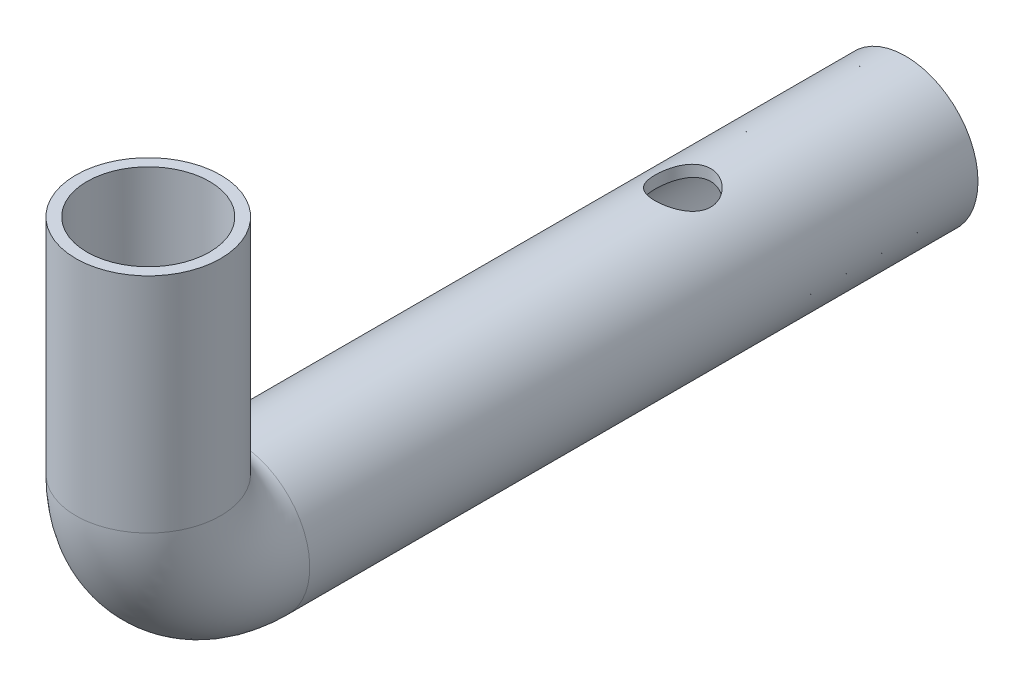
from build123d import *

# Parameters (mm, degrees)
SWEEP5_PROFILE_R        = 6.5
CUT_SWEEP1_PROFILE_R    = 5.5
CUT_EXTRUDE1_DEPTH      = 80.852990027
CUT_EXTRUDE1_DEPTH_BACK = 80.852990027
SKETCH30_R              = 2.5


with BuildPart() as part:
    # Sweep5: sweep along a path in Sketch2
    with BuildLine(Plane(origin=(0, 0, 0), x_dir=(0, 0, -1), z_dir=(1, 0, 0))) as sweep5_path:
        Line((0, 0), (-60, 0))
        ThreePointArc((-60, 0), (-65.656854249, 2.343145751), (-68, 8))
        Line((-68, 8), (-68, 28))
    # Sweep5 profile (on start of the path) → Sweep5 (sweep)
    with BuildSketch(Plane(origin=(0, 0, 0), x_dir=(0, 1, 0), z_dir=(0, 0, 1))):
        Circle(SWEEP5_PROFILE_R)
    sweep(path=sweep5_path.line)

    # Cut-Sweep1: sweep along a path in Sketch2<2>
    with BuildLine(Plane(origin=(0, 0, 0), x_dir=(0, 0, -1), z_dir=(1, 0, 0))) as cut_sweep1_path:
        Line((0, 0), (-60, 0))
        ThreePointArc((-60, 0), (-65.656854249, 2.343145751), (-68, 8))
        Line((-68, 8), (-68, 28))
    # Cut-Sweep1 profile (on start of the path) → Cut-Sweep1 (sweep, cut)
    with BuildSketch(Plane(origin=(0, 0, 0), x_dir=(0, 1, 0), z_dir=(0, 0, 1))):
        Circle(CUT_SWEEP1_PROFILE_R)
    sweep(path=cut_sweep1_path.line, mode=Mode.SUBTRACT)

    # Sketch30 → Cut-Extrude1 (cut, two sides: drawn at the far end of the back side and taken through both)
    with BuildSketch(Plane(origin=(0, 0, 0), x_dir=(1, 0, 0), z_dir=(0, 1, 0)).offset(-CUT_EXTRUDE1_DEPTH_BACK)):
        with Locations((0, -20)):
            Circle(SKETCH30_R)
    extrude(amount=CUT_EXTRUDE1_DEPTH + CUT_EXTRUDE1_DEPTH_BACK, mode=Mode.SUBTRACT)


solid = part.part
